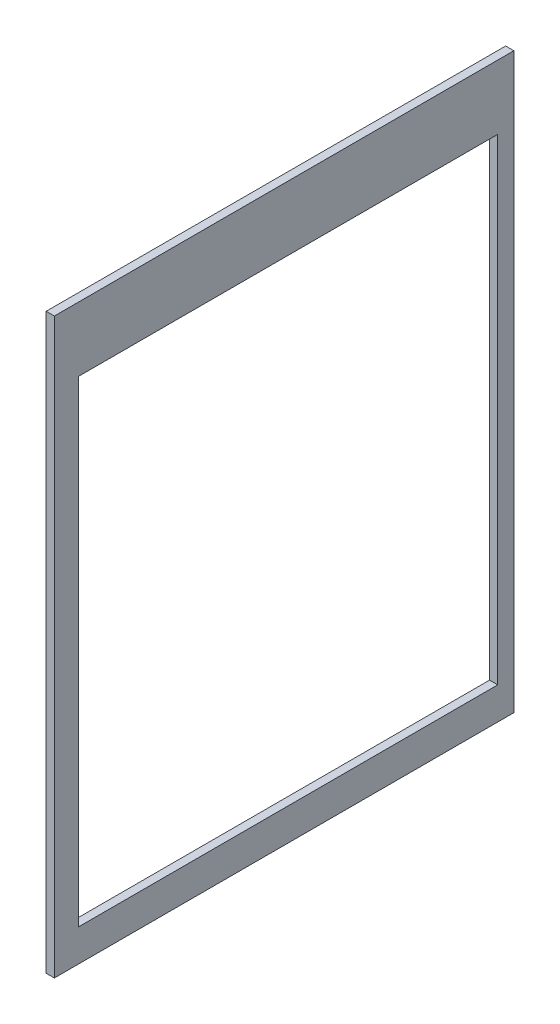
from build123d import *

# Parameters (mm, degrees)
CROQUIS1_W              = 280.5
CROQUIS1_H              = 350
CROQUIS1_W_2            = 255.937828371
CROQUIS1_H_2            = 291.050788091
SALIENTE_EXTRUIR2_DEPTH = 5


with BuildPart() as part:
    # Croquis1 → Saliente-Extruir2 (new body)
    with BuildSketch(Plane(origin=(0, 0, 0), x_dir=(0, 0, -1), z_dir=(1, 0, 0))):
        with Locations((-249.071741886, 151.782544853)):
            Rectangle(CROQUIS1_W, CROQUIS1_H)
        with Locations((-246.615524724, 141.957676201)):
            Rectangle(CROQUIS1_W_2, CROQUIS1_H_2, mode=Mode.SUBTRACT)
    extrude(amount=SALIENTE_EXTRUIR2_DEPTH)


solid = part.part
